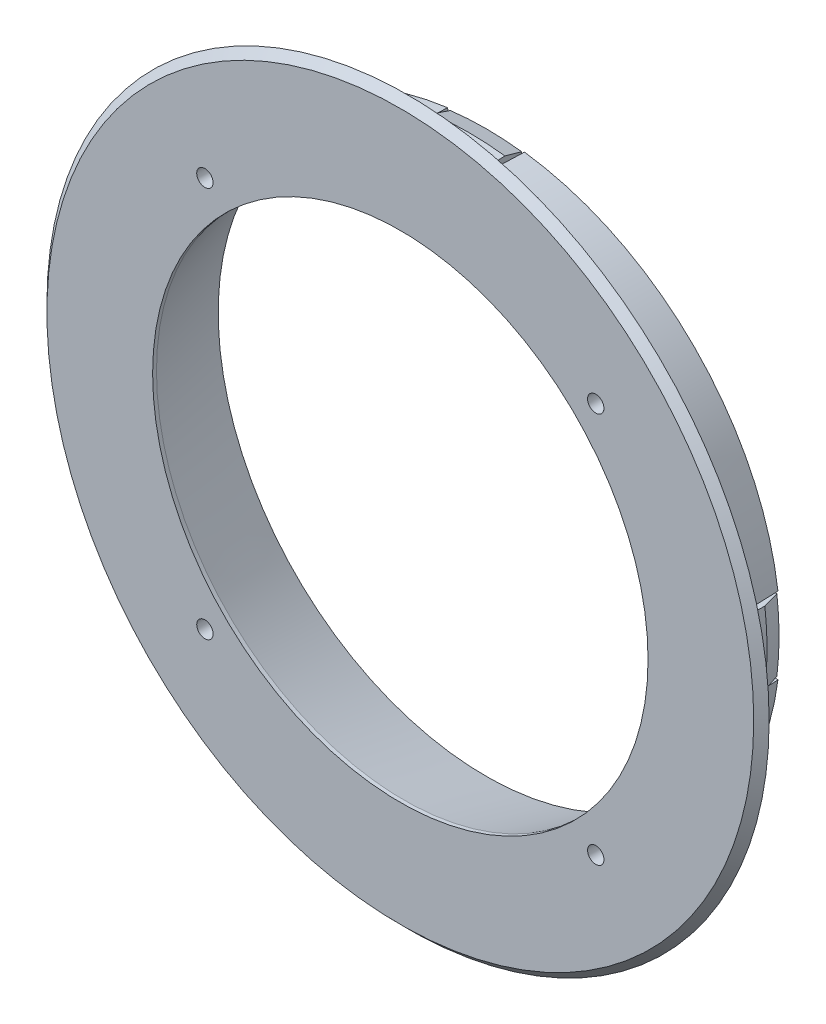
from build123d import *
from build123d.topology import SkipClean

# Parameters (mm, degrees)
CLAMP_CUTOFF_ANGLE = 15
CLAMP_BODY_ANGLE   = 14
CLAMP_ARRAY_COUNT  = 4
HOLES_ARRAY_COUNT  = 4


with BuildPart() as part:
    # Main_profile → Main_body (revolve)
    with BuildSketch(Plane(origin=(0, 0, 0), x_dir=(1, 0, 0), z_dir=(0, 1, 0))):
        Polygon((-75, 1.6), (-73.4, 0), (-51.449261084, 0), (-51.449261084, 0.8), (-55.629352876, 17.8), (-61.15, 17.8), (-61.8, 1.6), align=None)
    revolve(axis=Axis((0, 0, 21.596985385), (0, 0, -1)))

    # Эскиз1<8> → clamp_cutoff (revolve, symmetric, cut)
    with BuildSketch(Plane(origin=(0, 0, 0), x_dir=(1, 0, 0), z_dir=(0, 1, 0))) as clamp_cutoff_sk:
        Polygon((-61.643668663, 5.496257935), (-59.243668663, 5.496257935), (-58.643668663, 17.8), (-61.15, 17.8), align=None)
    clamp_cutoff = revolve(axis=Axis((0, 0, 21.596985385), (0, 0, -1)), revolution_arc=CLAMP_CUTOFF_ANGLE / 2, mode=Mode.SUBTRACT)
    clamp_cutoff = clamp_cutoff + revolve(clamp_cutoff_sk.sketch, axis=Axis((0, 0, 21.596985385), (0, 0, 1)), revolution_arc=CLAMP_CUTOFF_ANGLE / 2, mode=Mode.SUBTRACT)

    # Эскиз1<10> → Clamp_body (revolve, symmetric)
    with SkipClean():  # the faces are left unmerged after this step: merging them gives an invalid solid
        with BuildSketch(Plane(origin=(0, 0, 0), x_dir=(1, 0, 0), z_dir=(0, 1, 0))) as clamp_body_sk:
            Polygon((-61.61929281, 6.103779193), (-61.643668663, 5.496257935), (-59.643668663, 5.496257935), (-59.643668663, 17.8), (-60.863208673, 17.8), (-62, 14.17307305), align=None)
        clamp_body = revolve(axis=Axis((0, 0, 21.596985385), (0, 0, -1)), revolution_arc=CLAMP_BODY_ANGLE / 2)
        clamp_body = clamp_body + revolve(clamp_body_sk.sketch, axis=Axis((0, 0, 21.596985385), (0, 0, 1)), revolution_arc=CLAMP_BODY_ANGLE / 2)

    # Clamp_array: clamp_cutoff, Clamp_body ×4 about axis
    with SkipClean():  # the faces are left unmerged after this step: merging them gives an invalid solid
        clamp_array_axis = Axis((0, 0, -17.8), (0, 0, 1))
        add([clamp_cutoff.rotate(clamp_array_axis, i * 360 / CLAMP_ARRAY_COUNT) for i in range(1, CLAMP_ARRAY_COUNT)], mode=Mode.SUBTRACT)
        add([clamp_body.rotate(clamp_array_axis, i * 360 / CLAMP_ARRAY_COUNT) for i in range(1, CLAMP_ARRAY_COUNT)])

    # Hole_profile → Hole (revolve, cut)
    with SkipClean():  # the faces are left unmerged after this step: merging them gives an invalid solid
        with BuildSketch(Plane(origin=(0, 0, 0), x_dir=(0, 0, -1), z_dir=(0.7071067811865488, 0.7071067811865464, 0))):
            Polygon((0, 59.1), (0, 57.4), (15, 57.4), (12.921539031, 58.6), align=None)
        hole = revolve(axis=Axis((-40.58792924, 40.58792924, 2.268978304), (0, 0, -1)), mode=Mode.SUBTRACT)

    # Holes_array: Hole ×4 about axis
    with SkipClean():  # the faces are left unmerged after this step: merging them gives an invalid solid
        holes_array_axis = Axis((0, 0, 0), (0, 0, 1))
        for i in range(1, HOLES_ARRAY_COUNT):
            add(hole.rotate(holes_array_axis, i * 360 / HOLES_ARRAY_COUNT), mode=Mode.SUBTRACT)


solid = part.part
